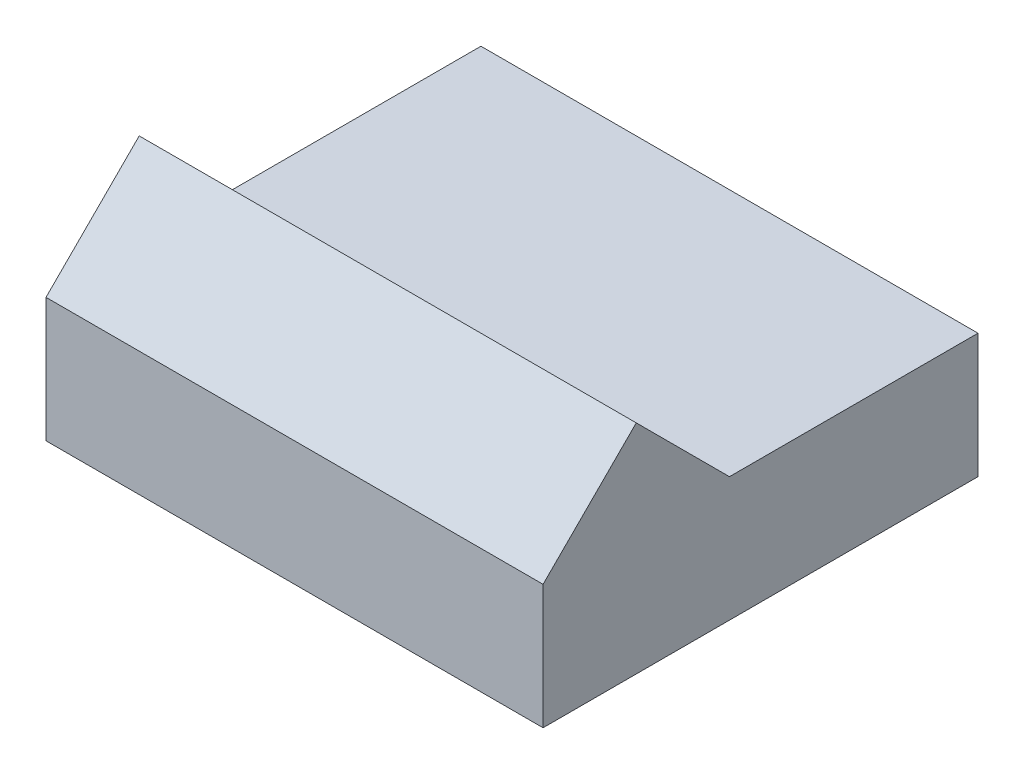
from build123d import *

# Parameters (mm, degrees)
BOSS_EXTRUDE1_DEPTH = 8


with BuildPart() as part:
    # Sketch2 → Boss-Extrude1 (new body)
    with BuildSketch(Plane(origin=(0, 0, 0), x_dir=(0, 0, -1), z_dir=(1, 0, 0))):
        Polygon((0.000317111, 27.796332929), (0.000317111, 29.796332929), (-3.999682889, 29.796332929), (-6.999682889, 29.796332929), (-6.999682889, 27.796332929), align=None)
        Polygon((-6.999682889, 29.796332929), (-3.999682889, 29.796332929), (-5.499682889, 31.296332929), align=None)
    extrude(amount=BOSS_EXTRUDE1_DEPTH)


solid = part.part
